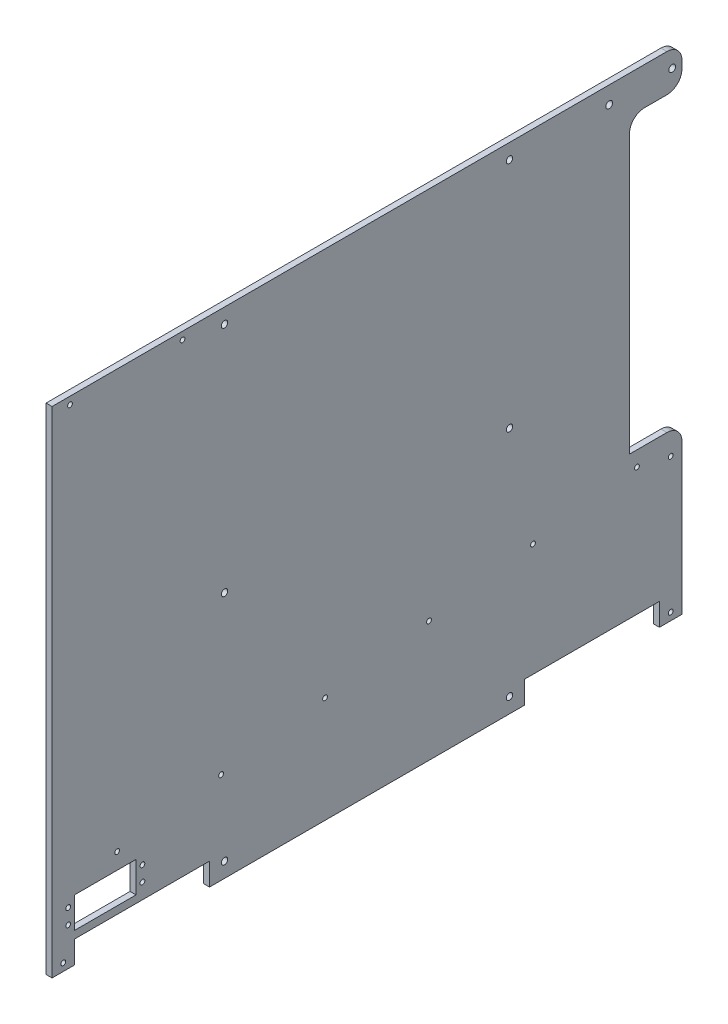
from build123d import *

# Parameters (mm, degrees)
EXTRUDE_1_DEPTH      = 4
SKETCH_2_R           = 1.6
SKETCH_2_W           = 90
SKETCH_2_H           = 15
CUT_EXTRUDE_1_DEPTH  = 268.097360526
SKETCH_3_R           = 2.15
CUT_EXTRUDE_3_DEPTH  = 5
SKETCH_4_R           = 2.25
CUT_EXTRUDE_5_DEPTH  = 5
SKETCH_5_W           = 35
SKETCH_5_H           = 195
CUT_EXTRUDE_6_DEPTH  = 5
SKETCH_8_R           = 1.6
CUT_EXTRUDE_8_DEPTH  = 5
SKETCH_9_R           = 1.6
CUT_EXTRUDE_9_DEPTH  = 5
SKETCH_10_R          = 1.6
SKETCH_10_W          = 41
SKETCH_10_H          = 20.5
CUT_EXTRUDE_10_DEPTH = 5
FILLET_1_R           = 10
SKETCH_11_R          = 1.6
CUT_EXTRUDE_11_DEPTH = 10


with BuildPart() as part:
    # 草图1 → 凸台-拉伸1 (new body)
    with BuildSketch(Plane(origin=(0, 0, 0), x_dir=(0, 0, -1), z_dir=(1, 0, 0))):
        with BuildLine():
            Line((200, 165), (-210, 165))
            Line((-210, 165), (-210, -165))
            Line((-210, -165), (210, -165))
            Line((210, -165), (210, 155))
            ThreePointArc((210, 155), (207.071067812, 162.071067812), (200, 165))
        make_face()
    extrude(amount=EXTRUDE_1_DEPTH)

    # 草图2 → 切除-拉伸1 (cut, through all)
    with BuildSketch(Plane(origin=(0, 0, 0), x_dir=(0, 0, -1), z_dir=(1, 0, 0))):
        with Locations((-202.5, -160)):
            Circle(SKETCH_2_R)
        with Locations((-150, -157.5)):
            Rectangle(SKETCH_2_W, SKETCH_2_H)
    cut_extrude_1 = extrude(amount=CUT_EXTRUDE_1_DEPTH, mode=Mode.SUBTRACT)

    # 镜向1: 切除-拉伸1 across plane
    add(cut_extrude_1.mirror(Plane.XY), mode=Mode.SUBTRACT)

    # 草图3 → 切除-拉伸3 (cut)
    with BuildSketch(Plane(origin=(4, 0, 0), x_dir=(0, 0, -1), z_dir=(1, 0, 0))):
        with Locations((95, 155)):
            Circle(SKETCH_3_R)
        with Locations((-95, 155)):
            Circle(SKETCH_3_R)
        with Locations(Location((95, -155, 0), (0, 0, 180))):
            Circle(SKETCH_3_R)
        with Locations(Location((-95, -155, 0), (0, 0, 180))):
            Circle(SKETCH_3_R)
        with Locations((-95, 0)):
            Circle(SKETCH_3_R)
        with Locations((95, 0)):
            Circle(SKETCH_3_R)
    extrude(amount=-CUT_EXTRUDE_3_DEPTH, mode=Mode.SUBTRACT)

    # 草图4 → 切除-拉伸5 (cut)
    with BuildSketch(Plane(origin=(4, 0, 0), x_dir=(0, 0, -1), z_dir=(1, 0, 0))):
        with Locations((203.5, 153.5)):
            Circle(SKETCH_4_R)
        with Locations((161.5, 153.5)):
            Circle(SKETCH_4_R)
    extrude(amount=-CUT_EXTRUDE_5_DEPTH, mode=Mode.SUBTRACT)

    # 草图5 → 切除-拉伸6 (cut)
    with BuildSketch(Plane(origin=(4, 0, 0), x_dir=(0, 0, -1), z_dir=(1, 0, 0))):
        with Locations((192.5, 42.5)):
            Rectangle(SKETCH_5_W, SKETCH_5_H)
    extrude(amount=-CUT_EXTRUDE_6_DEPTH, mode=Mode.SUBTRACT)

    # 草图8 → 切除-拉伸8 (cut)
    with BuildSketch(Plane.ZY):
        with Locations((-180, -65)):
            Circle(SKETCH_8_R)
        with Locations((-110.681235188, -74.742117067)):
            Circle(SKETCH_8_R)
        with Locations((-41.362470376, -84.484234134)):
            Circle(SKETCH_8_R)
        with Locations((27.956294436, -94.226351202)):
            Circle(SKETCH_8_R)
        with Locations((97.275059248, -103.968468269)):
            Circle(SKETCH_8_R)
        with Locations((166.59382406, -113.710585336)):
            Circle(SKETCH_8_R)
    extrude(amount=-CUT_EXTRUDE_8_DEPTH, mode=Mode.SUBTRACT)

    # 草图9 → 切除-拉伸9 (cut)
    with BuildSketch(Plane(origin=(4, 0, 0), x_dir=(0, 0, -1), z_dir=(1, 0, 0))):
        with Locations((-198, 160)):
            Circle(SKETCH_9_R)
        with Locations((-123, 160)):
            Circle(SKETCH_9_R)
    extrude(amount=-CUT_EXTRUDE_9_DEPTH, mode=Mode.SUBTRACT)

    # 草图10 → 切除-拉伸10 (cut)
    with BuildSketch(Plane(origin=(4, 0, 0), x_dir=(0, 0, -1), z_dir=(1, 0, 0))):
        with Locations((-199.25, -129.75)):
            Circle(SKETCH_10_R)
        with Locations((-199.25, -139.75)):
            Circle(SKETCH_10_R)
        with Locations(Location((-149.75, -139.75, 0), (0, 0, 180))):
            Circle(SKETCH_10_R)
        with Locations(Location((-149.75, -129.75, 0), (0, 0, 180))):
            Circle(SKETCH_10_R)
        with Locations((-174.5, -134.75)):
            Rectangle(SKETCH_10_W, SKETCH_10_H)
    extrude(amount=-CUT_EXTRUDE_10_DEPTH, mode=Mode.SUBTRACT)

    # 圆角1
    fillet_1_edges = [part.edges().sort_by_distance(p)[0] for p in [
        (2, -55, -210),
        (2, 140, -175),
        (2, 140, -210),
    ]]
    fillet(fillet_1_edges, radius=FILLET_1_R)

    # 草图11 → 切除-拉伸11 (cut)
    with BuildSketch(Plane(origin=(4, 0, 0), x_dir=(0, 0, -1), z_dir=(1, 0, 0))):
        with Locations((202.5, -70)):
            Circle(SKETCH_11_R)
    extrude(amount=-CUT_EXTRUDE_11_DEPTH, mode=Mode.SUBTRACT)


solid = part.part
